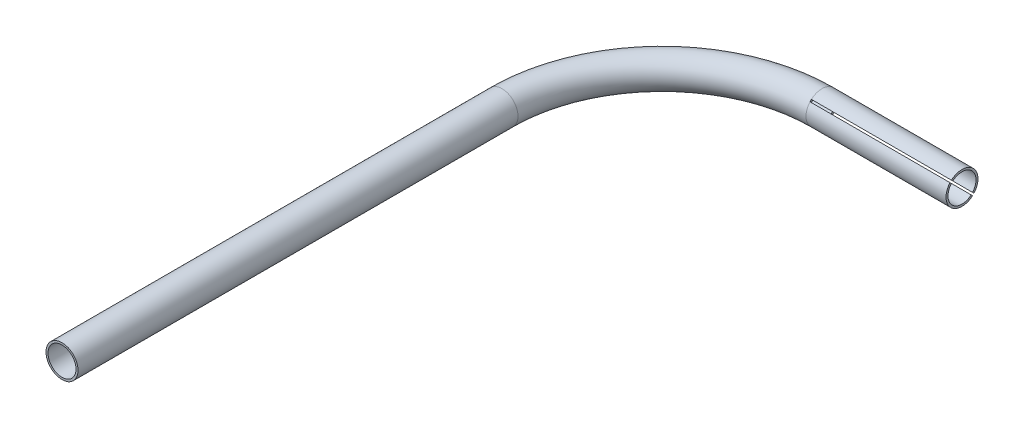
from build123d import *

# Parameters (mm, degrees)
SKETCH_2_R          = 8
SKETCH_2_R_2        = 7
CUT_EXTRUDE_1_DEPTH = 70


with BuildPart() as part:
    # По траектории1: sweep along a path in Эскиз1
    with BuildLine(Plane(origin=(0, 0, 0), x_dir=(1, 0, 0), z_dir=(0, 1, 0))) as sweep_1_path:
        Line((-150, -300), (-150, -80))
        ThreePointArc((-150, -80), (-126.568542495, -23.431457505), (-70, 0))
        Line((-70, 0), (0, 0))
    # Эскиз2 → По траектории1 (sweep)
    with BuildSketch(Plane(origin=(0, 0, 0), x_dir=(0, 0, -1), z_dir=(1, 0, 0))):
        Circle(SKETCH_2_R)
        Circle(SKETCH_2_R_2, mode=Mode.SUBTRACT)
    sweep(path=sweep_1_path.line)

    # Эскиз3 → Вырез-Вытянуть1 (cut)
    with BuildSketch(Plane(origin=(0, 0, 0), x_dir=(0, 0, -1), z_dir=(1, 0, 0))):
        Polygon((5.303300859, -6.01040764), (-6.01040764, 5.303300859), (-5.303300859, 6.01040764), (6.01040764, -5.303300859), align=None)
    extrude(amount=-CUT_EXTRUDE_1_DEPTH, mode=Mode.SUBTRACT)


solid = part.part
